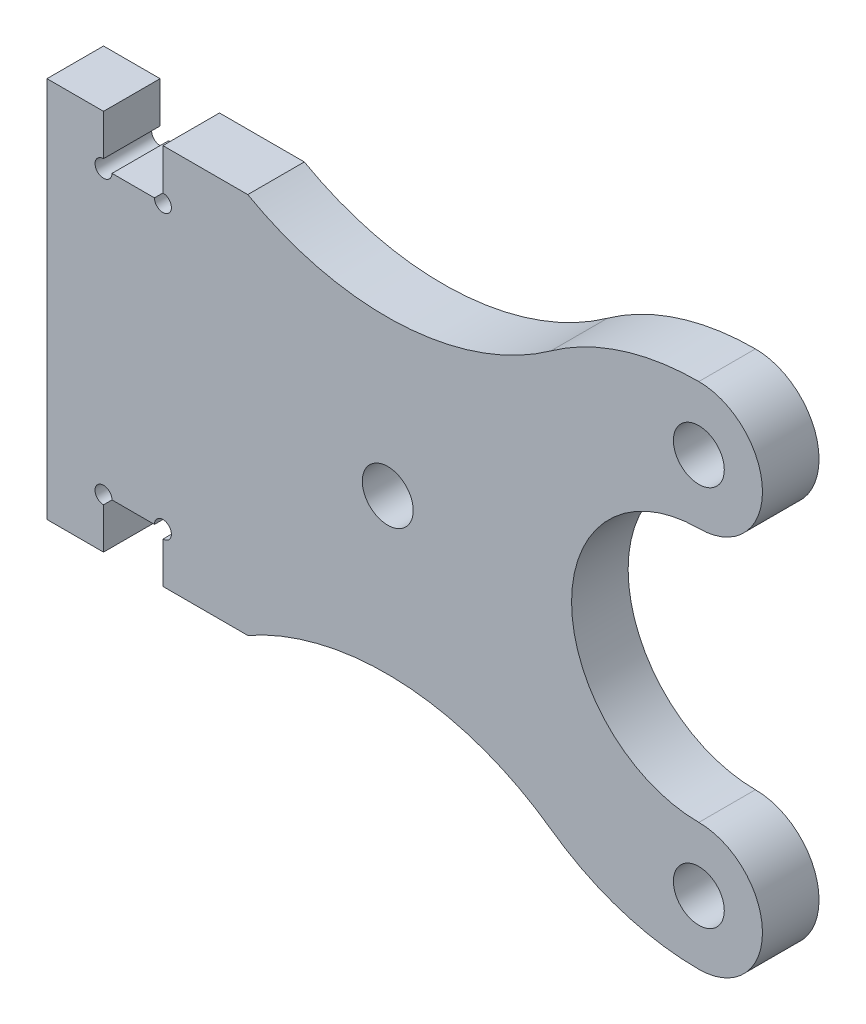
from build123d import *

# Parameters (mm, degrees)
SKETCH_1_R      = 0.9
EXTRUDE_1_DEPTH = 2


with BuildPart() as part:
    # 草图1 → 凸台-拉伸1 (new body)
    with BuildSketch(Plane.XY):
        with BuildLine():
            Line((-13.95, -5.299998555), (-13.95, -6.75))
            Line((-13.95, -6.75), (-10.95, -6.75))
            ThreePointArc((-10.95, -6.75), (-5.506483958, -5.47673518), (-0.23016259, -7.324301965))
            ThreePointArc((-0.23016259, -7.324301965), (2.253977211, -8.570843532), (5, -9))
            ThreePointArc((5, -9), (7.25, -6.75), (5, -4.5))
            ThreePointArc((5, -4.5), (0.5, 0), (5, 4.5))
            ThreePointArc((5, 4.5), (7.25, 6.75), (5, 9))
            ThreePointArc((5, 9), (2.253977211, 8.570843532), (-0.23016259, 7.324301965))
            ThreePointArc((-0.23016259, 7.324301965), (-5.506483958, 5.47673518), (-10.95, 6.75))
            Line((-10.95, 6.75), (-13.95, 6.75))
            Line((-13.95, 6.75), (-13.95, 5.299998555))
            ThreePointArc((-13.95, 5.299998555), (-13.737867966, 4.787866521), (-14.25, 4.999998555))
            Line((-14.25, 4.999998555), (-15.75, 4.999998555))
            ThreePointArc((-15.75, 4.999998555), (-16.262132034, 4.787866521), (-16.05, 5.299998555))
            Line((-16.05, 5.299998555), (-16.05, 6.75))
            Line((-16.05, 6.75), (-18.05, 6.75))
            Line((-18.05, 6.75), (-18.05, -6.75))
            Line((-18.05, -6.75), (-16.05, -6.75))
            Line((-16.05, -6.75), (-16.05, -5.299998555))
            ThreePointArc((-16.05, -5.299998555), (-16.262132034, -4.787866521), (-15.75, -4.999998555))
            Line((-15.75, -4.999998555), (-14.25, -4.999998555))
            ThreePointArc((-14.25, -4.999998555), (-13.737867966, -4.787866521), (-13.95, -5.299998555))
        make_face()
        with Locations((-6, 0)):
            Circle(SKETCH_1_R, mode=Mode.SUBTRACT)
        with Locations((5, 6.75)):
            Circle(SKETCH_1_R, mode=Mode.SUBTRACT)
        with Locations((5, -6.75)):
            Circle(SKETCH_1_R, mode=Mode.SUBTRACT)
    extrude(amount=EXTRUDE_1_DEPTH)


solid = part.part
